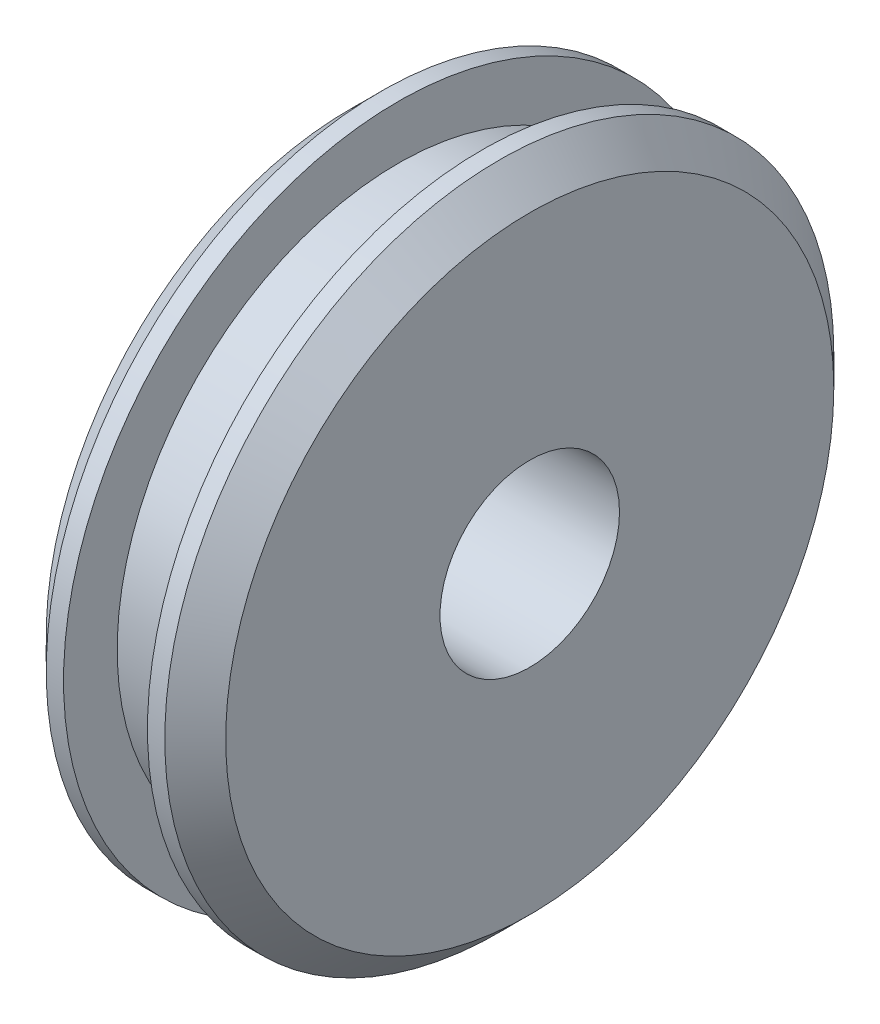
from build123d import *

# Parameters (mm, degrees)
SKETCH3_R          = 5.08
CUT_EXTRUDE1_DEPTH = 29.638898375


with BuildPart() as part:
    # Sketch2 → Revolve1 (revolve)
    with BuildSketch(Plane.XY, mode=Mode.PRIVATE) as revolve1_sk:
        Polygon((0, 0), (-10.16, 0), (-10.16, 17.209662464), (-8.436082504, 18.933579959), (-7.4549, 18.933579959), (-7.4549, 15.898279959), (-2.7051, 15.898279959), (-2.7051, 18.933579959), (-1.723917496, 18.933579959), (0, 17.209662464), align=None)
    revolve(revolve1_sk.sketch.rotate(Axis((0, 0, 0), (-1, 0, 0)), 90), axis=Axis((0, 0, 0), (-1, 0, 0)))

    # Sketch3 → Cut-Extrude1 (cut, through all)
    with BuildSketch(Plane(origin=(0, 0, 0), x_dir=(0, 0, -1), z_dir=(1, 0, 0))):
        Circle(SKETCH3_R)
    extrude(amount=-CUT_EXTRUDE1_DEPTH, mode=Mode.SUBTRACT)


solid = part.part
